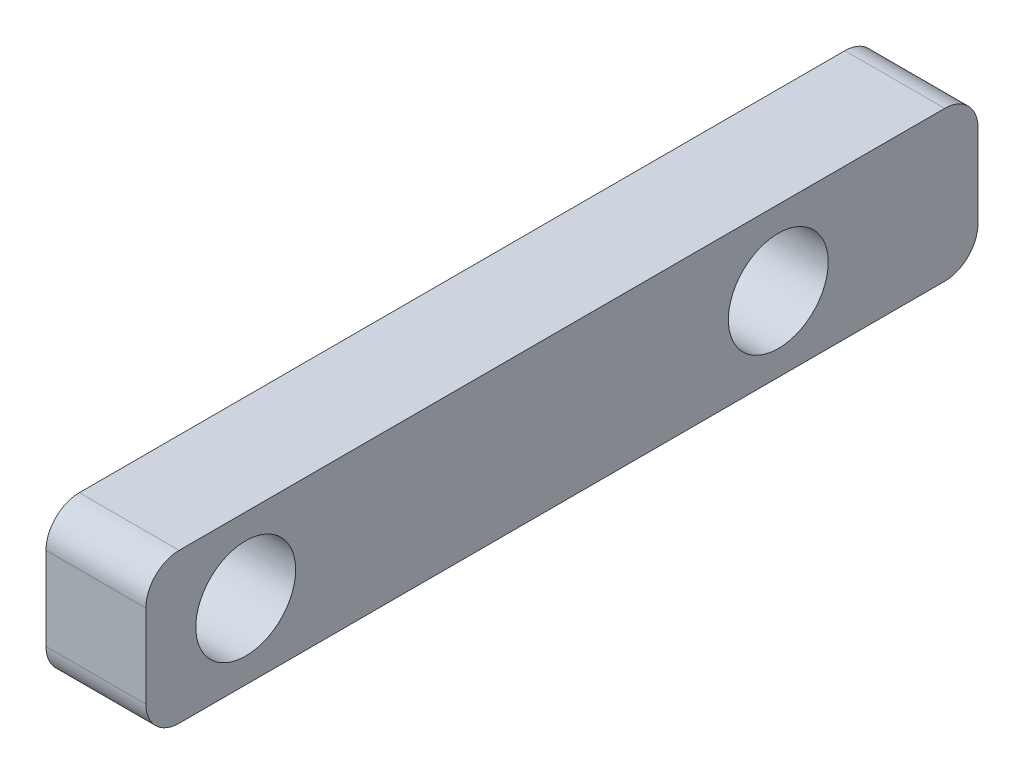
from build123d import *

# Parameters (mm, degrees)
SALIENTE_EXTRUIR1_DEPTH    = 1.5
CORTAR_EXTRUIR1_DEPTH      = 13.789155562
CORTAR_EXTRUIR1_DEPTH_BACK = 13.789155562
CROQUIS2_R                 = 1.5


with BuildPart() as part:
    # Croquis1 → Saliente-Extruir1 (new, symmetric)
    with BuildSketch(Plane(origin=(0, 0, 0), x_dir=(0, 0, -1), z_dir=(1, 0, 0))):
        with BuildLine():
            Line((-11.5, 2.25), (11.5, 2.25))
            ThreePointArc((11.5, 2.25), (12.207106781, 1.957106781), (12.5, 1.25))
            Line((12.5, 1.25), (12.5, -1.25))
            ThreePointArc((12.5, -1.25), (12.207106781, -1.957106781), (11.5, -2.25))
            Line((11.5, -2.25), (-11.5, -2.25))
            ThreePointArc((-11.5, -2.25), (-12.207106781, -1.957106781), (-12.5, -1.25))
            Line((-12.5, -1.25), (-12.5, 1.25))
            ThreePointArc((-12.5, 1.25), (-12.207106781, 1.957106781), (-11.5, 2.25))
        make_face()
    extrude(amount=SALIENTE_EXTRUIR1_DEPTH, both=True)

    # Croquis2 → Cortar-Extruir1 (cut, two sides: drawn at the far end of the back side and taken through both)
    with BuildSketch(Plane(origin=(0, 0, 0), x_dir=(0, 0, -1), z_dir=(1, 0, 0)).offset(-CORTAR_EXTRUIR1_DEPTH_BACK)):
        with Locations((-9.5, 0)):
            Circle(CROQUIS2_R)
        with Locations((6.5, 0)):
            Circle(CROQUIS2_R)
    extrude(amount=CORTAR_EXTRUIR1_DEPTH + CORTAR_EXTRUIR1_DEPTH_BACK, mode=Mode.SUBTRACT)


solid = part.part
